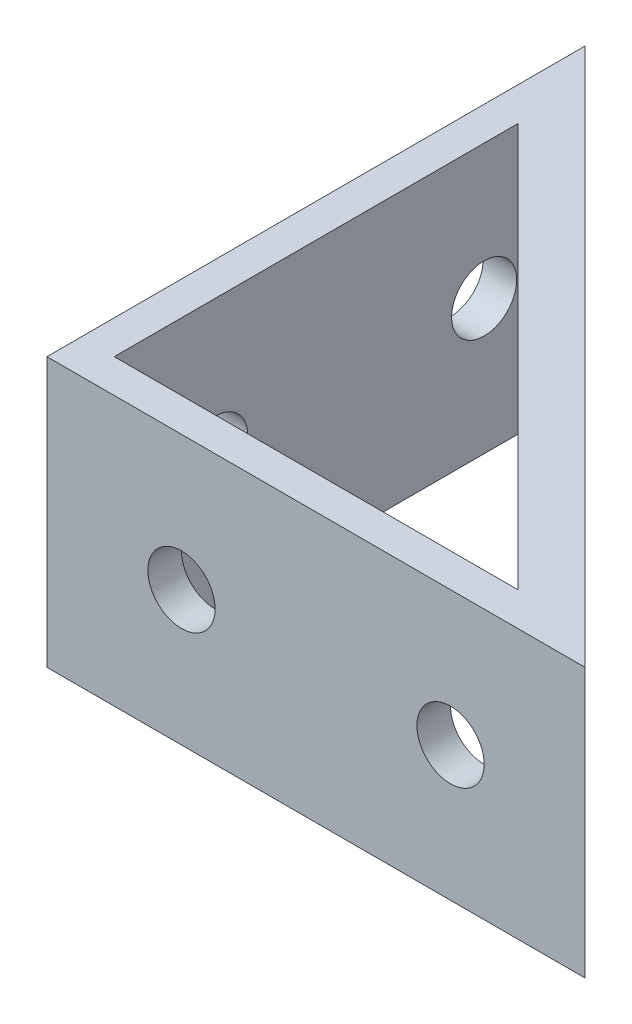
from build123d import *

# Parameters (mm, degrees)
BOSS_EXTRUDE1_DEPTH         = 25.4
C_0_242_DIAMETER_HOLE1_D    = 6.1468
F_1_4_0_25_DIAMETER_HOLE1_D = 6.35


with BuildPart() as part:
    # Sketch1 → Boss-Extrude1 (new body)
    with BuildSketch(Plane(origin=(0, 0, 0), x_dir=(1, 0, 0), z_dir=(0, 1, 0))):
        Polygon((0, 0), (0, 50.8), (50.8, 0), align=None)
        Polygon((3.175, 3.175), (3.175, 41.275), (41.275, 3.175), align=None, mode=Mode.SUBTRACT)
    extrude(amount=BOSS_EXTRUDE1_DEPTH)

    # C (0.242) Diameter Hole1 (through all)
    with Locations(Plane.ZY):
        with Locations((-12.7, 12.7), (-38.1, 12.7)):
            Hole(C_0_242_DIAMETER_HOLE1_D / 2)

    # 1/4 (0.25) Diameter Hole1 (through all)
    with Locations(Plane.XY):
        with Locations((38.1, 12.7), (12.7, 12.7)):
            Hole(F_1_4_0_25_DIAMETER_HOLE1_D / 2)


solid = part.part
